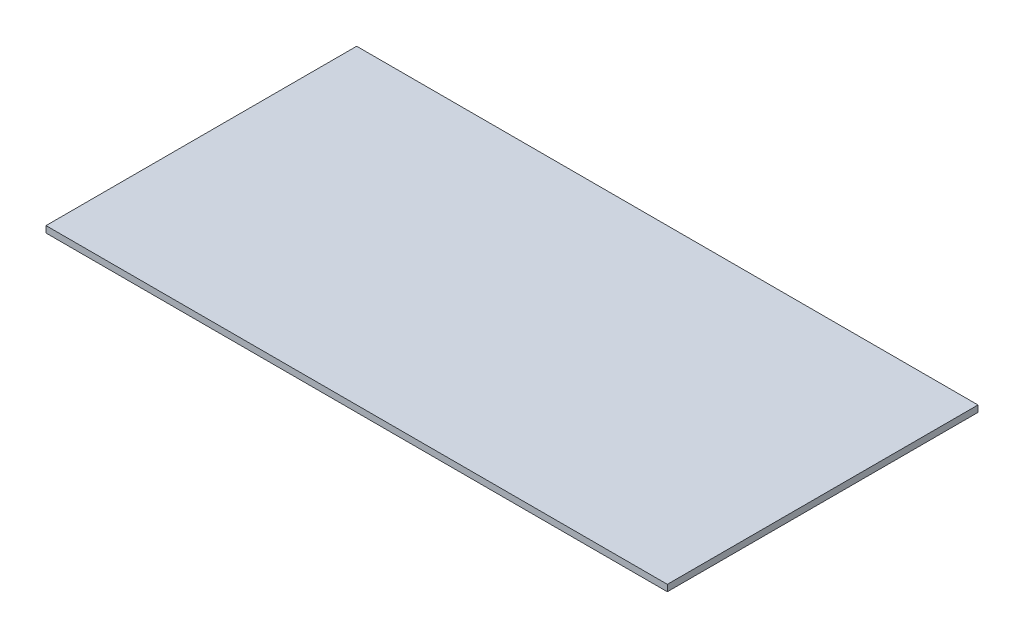
from build123d import *

# Parameters (mm, degrees)
SKETCH1_W           = 1219.2
SKETCH1_H           = 609.6
BOSS_EXTRUDE1_DEPTH = 12.7


with BuildPart() as part:
    # Sketch1 → Boss-Extrude1 (new body)
    with BuildSketch(Plane(origin=(0, 0, 0), x_dir=(1, 0, 0), z_dir=(0, 1, 0))):
        Rectangle(SKETCH1_W, SKETCH1_H)
    extrude(amount=BOSS_EXTRUDE1_DEPTH)


solid = part.part
